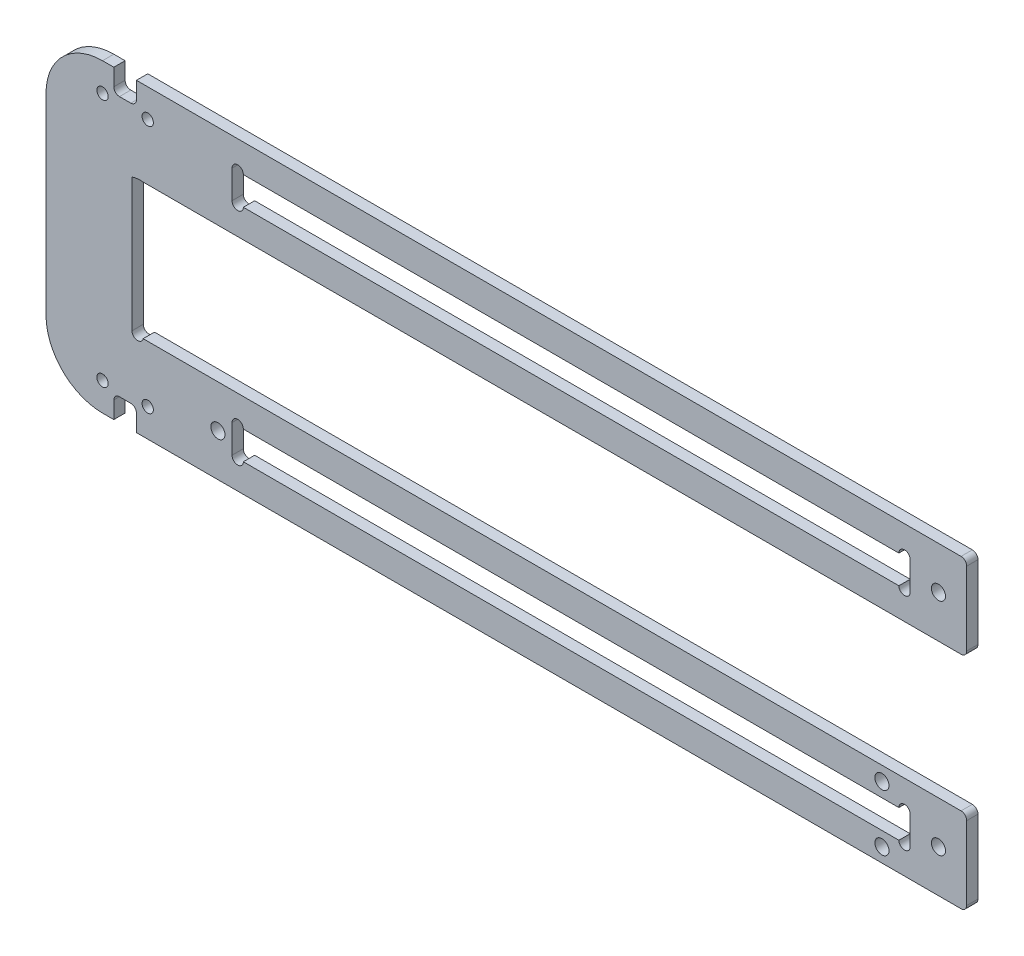
from build123d import *

# Parameters (mm, degrees)
SKETCH_1_R          = 1
SKETCH_1_R_2        = 1.25
EXTRUDE_2_DEPTH     = 2
SKETCH_2_R          = 1.25
CUT_EXTRUDE_1_DEPTH = 10


with BuildPart() as part:
    # 草圖1 → 填料-伸長2 (new body)
    with BuildSketch(Plane.XY):
        with BuildLine():
            Line((55.038502783, 45.173220339), (55.038502783, 32.173220339))
            ThreePointArc((55.038502783, 32.173220339), (54.745609564, 31.466113558), (54.038502783, 31.173220339))
            Line((54.038502783, 31.173220339), (-90.763626261, 31.173220339))
            ThreePointArc((-90.763626261, 31.173220339), (-91.726620083, 31.171182694), (-92.665560041, 30.957283163))
            Line((-92.665560041, 30.957283163), (-92.665560041, 7.389157515))
            ThreePointArc((-92.665560041, 7.389157515), (-91.774171138, 6.395073197), (-90.689152782, 7.173220339))
            Line((-90.689152782, 7.173220339), (54.038502783, 7.173220339))
            ThreePointArc((54.038502783, 7.173220339), (54.745609564, 6.88032712), (55.038502783, 6.173220339))
            Line((55.038502783, 6.173220339), (55.038502783, -6.826779661))
            ThreePointArc((55.038502783, -6.826779661), (54.745609564, -7.533886442), (54.038502783, -7.826779661))
            Line((54.038502783, -7.826779661), (-91.881497217, -7.826779661))
            Line((-91.881497217, -7.826779661), (-91.881497217, -4.826779661))
            ThreePointArc((-91.881497217, -4.826779661), (-92.174390436, -4.11967288), (-92.881497217, -3.826779661))
            Line((-92.881497217, -3.826779661), (-94.881497217, -3.826779661))
            ThreePointArc((-94.881497217, -3.826779661), (-95.588603998, -4.11967288), (-95.881497217, -4.826779661))
            Line((-95.881497217, -4.826779661), (-95.881497217, -7.826779661))
            Line((-95.881497217, -7.826779661), (-97.881497217, -7.826779661))
            ThreePointArc((-97.881497217, -7.826779661), (-104.952565029, -4.897847473), (-107.881497217, 2.173220339))
            Line((-107.881497217, 2.173220339), (-107.881497217, 36.173220339))
            ThreePointArc((-107.881497217, 36.173220339), (-104.952565029, 43.244288151), (-97.881497217, 46.173220339))
            Line((-97.881497217, 46.173220339), (-95.881497217, 46.173220339))
            Line((-95.881497217, 46.173220339), (-95.881497217, 43.173220339))
            ThreePointArc((-95.881497217, 43.173220339), (-95.588603998, 42.466113558), (-94.881497217, 42.173220339))
            Line((-94.881497217, 42.173220339), (-92.881497217, 42.173220339))
            ThreePointArc((-92.881497217, 42.173220339), (-92.174390436, 42.466113558), (-91.881497217, 43.173220339))
            Line((-91.881497217, 43.173220339), (-91.881497217, 46.173220339))
            Line((-91.881497217, 46.173220339), (54.038502783, 46.173220339))
            ThreePointArc((54.038502783, 46.173220339), (54.745609564, 45.88032712), (55.038502783, 45.173220339))
        make_face()
        with Locations((-97.881497217, 41.173220339)):
            Circle(SKETCH_1_R, mode=Mode.SUBTRACT)
        with Locations((-89.881497217, 41.173220339)):
            Circle(SKETCH_1_R, mode=Mode.SUBTRACT)
        with Locations((-89.881497217, -2.826779661)):
            Circle(SKETCH_1_R, mode=Mode.SUBTRACT)
        with Locations((-97.881497217, -2.826779661)):
            Circle(SKETCH_1_R, mode=Mode.SUBTRACT)
        with Locations((50.038502783, 38.673220339)):
            Circle(SKETCH_1_R_2, mode=Mode.SUBTRACT)
        with Locations((50.038502783, -0.326779661)):
            Circle(SKETCH_1_R_2, mode=Mode.SUBTRACT)
        with BuildLine():
            Line((-74.961497217, -2.826779661), (-74.961497217, 2.173220339))
            ThreePointArc((-74.961497217, 2.173220339), (-73.961497217, 3.173220339), (-72.961497217, 2.173220339))
            Line((-72.961497217, 2.173220339), (43.038502783, 2.173220339))
            ThreePointArc((43.038502783, 2.173220339), (44.038502783, 3.173220339), (45.038502783, 2.173220339))
            Line((45.038502783, 2.173220339), (45.038502783, -2.826779661))
            ThreePointArc((45.038502783, -2.826779661), (44.038502783, -3.826779661), (43.038502783, -2.826779661))
            Line((43.038502783, -2.826779661), (-72.961497217, -2.826779661))
            ThreePointArc((-72.961497217, -2.826779661), (-73.961497217, -3.826779661), (-74.961497217, -2.826779661))
        make_face(mode=Mode.SUBTRACT)
        with BuildLine():
            Line((43.038502783, 41.173220339), (-72.961497217, 41.173220339))
            ThreePointArc((-72.961497217, 41.173220339), (-73.961497217, 42.173220339), (-74.961497217, 41.173220339))
            Line((-74.961497217, 41.173220339), (-74.961497217, 36.173220339))
            ThreePointArc((-74.961497217, 36.173220339), (-73.961497217, 35.173220339), (-72.961497217, 36.173220339))
            Line((-72.961497217, 36.173220339), (43.038502783, 36.173220339))
            ThreePointArc((43.038502783, 36.173220339), (44.038502783, 35.173220339), (45.038502783, 36.173220339))
            Line((45.038502783, 36.173220339), (45.038502783, 41.173220339))
            ThreePointArc((45.038502783, 41.173220339), (44.038502783, 42.173220339), (43.038502783, 41.173220339))
        make_face(mode=Mode.SUBTRACT)
    extrude(amount=EXTRUDE_2_DEPTH)

    # 草圖2 → 除料-伸長1 (cut)
    with BuildSketch(Plane.XY.offset(2)):
        with Locations((-77.461497217, -0.326779661)):
            Circle(SKETCH_2_R)
        with Locations((40.038502783, 4.673220339)):
            Circle(SKETCH_2_R)
        with Locations((40.038502783, -5.326779661)):
            Circle(SKETCH_2_R)
    extrude(amount=-CUT_EXTRUDE_1_DEPTH, mode=Mode.SUBTRACT)


solid = part.part
